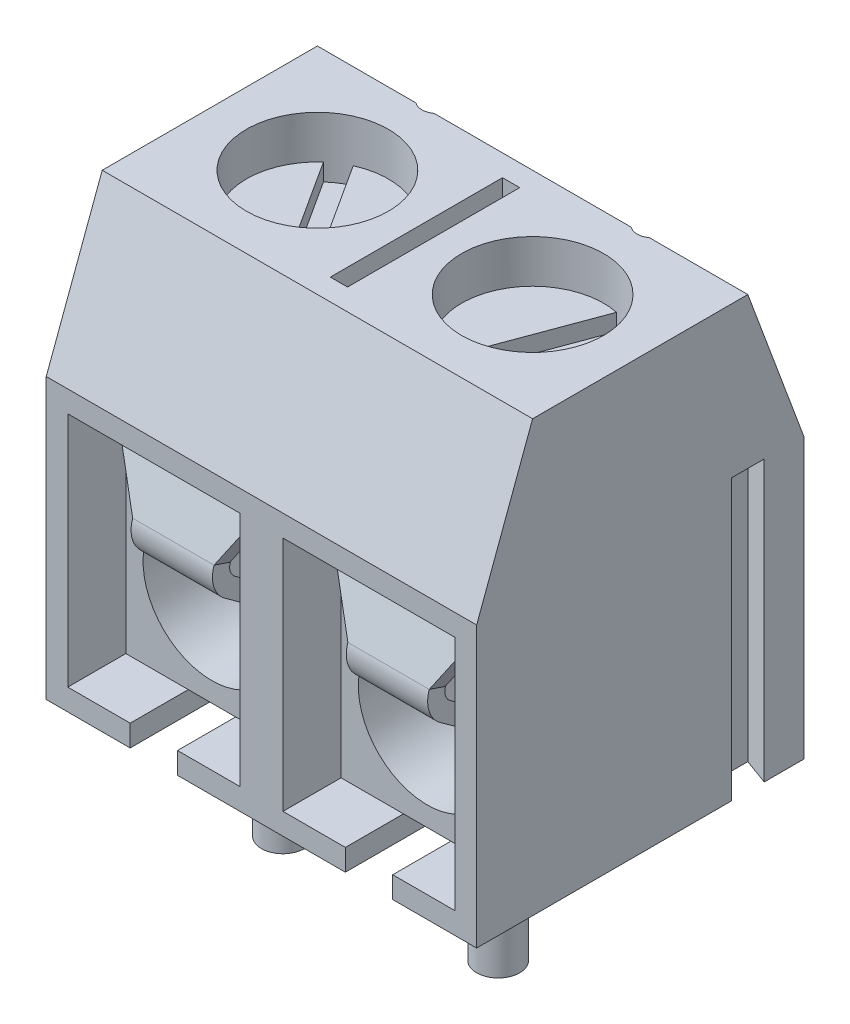
from build123d import *

# Parameters (mm, degrees)
SKETCH1_W               = 10
SKETCH1_H               = 7.6
EXTRUDE1_DEPTH          = 10
CUT_EXTRUDE1_DEPTH      = 12.808471535
CUT_EXTRUDE1_DEPTH_BACK = 12.808471535
SKETCH2_OUTSIDE_W       = 12.81
SKETCH2_OUTSIDE_H       = 15.21
SKETCH3_R               = 1.65
SKETCH3_R_2             = 0.35
SKETCH3_W               = 0.4
SKETCH3_H               = 4
CUT_EXTRUDE2_DEPTH      = 4
SKETCH4_W               = 4
SKETCH4_H               = 5.5
CUT_EXTRUDE3_DEPTH      = 5.6
SKETCH5_W               = 4
SKETCH5_H               = 5.1
EXTRUDE2_DEPTH          = 4.25
SKETCH6_R               = 1.6
CUT_EXTRUDE4_DEPTH      = 4.25
EXTRUDE3_DEPTH          = 6.5
CUT_EXTRUDE5_DEPTH      = 6.5
SKETCH10_W              = 1.1
SKETCH10_H              = 0.5
CUT_EXTRUDE6_DEPTH      = 3.6
SKETCH11_R              = 0.5
EXTRUDE4_DEPTH          = 3.5
EXTRUDE5_START          = -3
SKETCH12_R              = 1.65
EXTRUDE5_DEPTH          = 3
CUT_EXTRUDE7_DEPTH      = 0.4
EXTRUDE6_DEPTH          = 0.945
EXTRUDE9_DEPTH          = 0.39
LPATTERN1_COUNT         = 2
LPATTERN1_PITCH         = 5
FILLET1_R               = 0.3
FILLET2_R               = 0.7


with BuildPart() as part:
    # Sketch1 → Extrude1 (new body)
    with BuildSketch(Plane(origin=(0, 0, 0), x_dir=(1, 0, 0), z_dir=(0, 1, 0))):
        Rectangle(SKETCH1_W, SKETCH1_H)
    extrude(amount=EXTRUDE1_DEPTH)

    # Sketch2 outside → Cut-Extrude1 (cut, two sides: drawn at the far end of the back side and taken through both)
    with BuildSketch(Plane(origin=(0, 0, 0), x_dir=(0, 0, -1), z_dir=(1, 0, 0)).offset(-CUT_EXTRUDE1_DEPTH_BACK)):
        with Locations((0, 5)):
            Rectangle(SKETCH2_OUTSIDE_W, SKETCH2_OUTSIDE_H)
        Polygon((2.5, 10), (3.8, 6.5), (3.8, 0), (-3.8, 0), (-3.8, 6.5), (-2.5, 10), align=None, mode=Mode.SUBTRACT)
    extrude(amount=CUT_EXTRUDE1_DEPTH + CUT_EXTRUDE1_DEPTH_BACK, mode=Mode.SUBTRACT)

    # Sketch3 → Cut-Extrude2 (cut)
    with BuildSketch(Plane(origin=(0, 10, 0), x_dir=(-1, 0, 0), z_dir=(0, 1, 0))):
        with Locations(Location((2.5, 0, 0), (0, 0, 90))):
            Circle(SKETCH3_R)
        with Locations(Location((-2.5, 0, 0), (0, 0, 90))):
            Circle(SKETCH3_R)
        with Locations(Location((2.5, -2.78, 0), (0, 0, 90))):
            Circle(SKETCH3_R_2)
        with Locations(Location((-2.5, -2.78, 0), (0, 0, 90))):
            Circle(SKETCH3_R_2)
        Rectangle(SKETCH3_W, SKETCH3_H)
    extrude(amount=-CUT_EXTRUDE2_DEPTH, mode=Mode.SUBTRACT)

    # Sketch4 → Cut-Extrude3 (cut)
    with BuildSketch(Plane.XY.offset(3.8)):
        with Locations((-2.5, 3.25)):
            Rectangle(SKETCH4_W, SKETCH4_H)
        with Locations((2.5, 3.25)):
            Rectangle(SKETCH4_W, SKETCH4_H)
    extrude(amount=-CUT_EXTRUDE3_DEPTH, mode=Mode.SUBTRACT)

    # Sketch5 → Extrude2 (add)
    with BuildSketch(Plane.XY.offset(-1.8)):
        with Locations((-2.5, 3.05)):
            Rectangle(SKETCH5_W, SKETCH5_H)
        with Locations((2.5, 3.05)):
            Rectangle(SKETCH5_W, SKETCH5_H)
    extrude(amount=EXTRUDE2_DEPTH)

    # Sketch6 → Cut-Extrude4 (cut)
    with BuildSketch(Plane.XY.offset(2.45)):
        with Locations((-2.5, 2.554263468)):
            Circle(SKETCH6_R)
        with Locations((2.5, 2.554263468)):
            Circle(SKETCH6_R)
    extrude(amount=-CUT_EXTRUDE4_DEPTH, mode=Mode.SUBTRACT)

    # Sketch7 → Extrude3 (add)
    with BuildSketch(Plane(origin=(0, 0, 0), x_dir=(1, 0, 0), z_dir=(0, 1, 0))):
        Polygon((-5.6, 3.1), (-5, 2.881617859), (-5, 2.118382141), (-5.6, 1.9), align=None)
    extrude(amount=EXTRUDE3_DEPTH)

    # Sketch9 → Cut-Extrude5 (cut)
    with BuildSketch(Plane(origin=(0, 0, 0), x_dir=(1, 0, 0), z_dir=(0, 1, 0))):
        Polygon((5, 2.881617859), (4.4, 3.1), (4.4, 1.9), (5, 2.118382141), align=None)
    extrude(amount=CUT_EXTRUDE5_DEPTH, mode=Mode.SUBTRACT)

    # Sketch10 → Cut-Extrude6 (cut)
    with BuildSketch(Plane.XY.offset(3.8)):
        with Locations((-2.5, 0.25)):
            Rectangle(SKETCH10_W, SKETCH10_H)
        with Locations((2.5, 0.25)):
            Rectangle(SKETCH10_W, SKETCH10_H)
    extrude(amount=-CUT_EXTRUDE6_DEPTH, mode=Mode.SUBTRACT)

    # Sketch11 → Extrude4 (add)
    with BuildSketch(Plane.XZ.offset(-0.5)):
        with Locations(Location((-2.5, 0.8, 0), (0, 0, 90))):
            Circle(SKETCH11_R)
        with Locations(Location((2.5, 0.8, 0), (0, 0, 90))):
            Circle(SKETCH11_R)
    extrude(amount=EXTRUDE4_DEPTH)

    # Sketch12 → Extrude5 (add)
    with BuildSketch(Plane.XZ.offset(-6).offset(EXTRUDE5_START)):
        with Locations(Location((2.5, 0, 0), (0, 0, 90))):
            Circle(SKETCH12_R)
        with Locations(Location((-2.5, 0, 0), (0, 0, 90))):
            Circle(SKETCH12_R)
    extrude(amount=EXTRUDE5_DEPTH)

    # Sketch13 → Cut-Extrude7 (cut)
    with BuildSketch(Plane(origin=(0, 9, 0), x_dir=(-1, 0, 0), z_dir=(0, 1, 0))):
        with BuildLine():
            Line((3.594307251, -1.234905519), (1.825829895, 1.505986278))
            ThreePointArc((1.825829895, 1.505986278), (1.605433494, 1.386452583), (1.405692749, 1.234905519))
            Line((1.405692749, 1.234905519), (3.174170105, -1.505986278))
            ThreePointArc((3.174170105, -1.505986278), (3.394566506, -1.386452583), (3.594307251, -1.234905519))
        make_face()
        with BuildLine():
            Line((-2.83217089, -1.616218581), (-1.698971441, 1.44251629))
            ThreePointArc((-1.698971441, 1.44251629), (-1.926782442, 1.54723031), (-2.16782911, 1.616218581))
            Line((-2.16782911, 1.616218581), (-3.301028559, -1.44251629))
            ThreePointArc((-3.301028559, -1.44251629), (-3.073217558, -1.54723031), (-2.83217089, -1.616218581))
        make_face()
    extrude(amount=-CUT_EXTRUDE7_DEPTH, mode=Mode.SUBTRACT)

    # Sketch14 → Extrude6 (add, symmetric)
    with BuildSketch(Plane.ZY.offset(2.5)):
        Polygon((2.45, 5.6), (3.03887637, 3.861674443), (0.167170254, 1.787608865), (-0.546359637, 2.097431054), (-0.705673534, 1.730526322), (0.216750724, 1.33), (3.512480259, 3.710312924), (2.736824279, 6), (-1.8, 6), (-1.8, 5.6), align=None)
    extrude6 = extrude(amount=EXTRUDE6_DEPTH, both=True)

    # Sketch15 → Extrude9 (add)
    with BuildSketch(Plane(origin=(0, 1.449355072, 4.278403908), x_dir=(1, 0, 0), z_dir=(0, 0.32085037888995993, 0.9471298930802308))):
        Polygon((-1.555, 4.8), (-1.555, 2.903968921), (-0.51, 4.8), align=None)
        Polygon((-3.445, 4.8), (-3.445, 2.903968921), (-4.49, 4.8), align=None)
    extrude9 = extrude(amount=-EXTRUDE9_DEPTH)

    # LPattern1: Extrude6, Extrude9 ×2
    with Locations(*[(i * LPATTERN1_PITCH, 0, 0) for i in range(1, LPATTERN1_COUNT)]):
        add(extrude6)
        add(extrude9)

    # Fillet1
    fillet1_edges = [part.edges().sort_by_distance(p)[0] for p in [
        (-2.5, 3.861674443, 3.03887637),
        (-2.5, 1.787608865, 0.167170254),
        (2.5, 3.861674443, 3.03887637),
        (2.5, 1.787608865, 0.167170254),
    ]]
    fillet(fillet1_edges, radius=FILLET1_R)

    # Fillet2
    fillet2_edges = [part.edges().sort_by_distance(p)[0] for p in [
        (-2.5, 3.710312924, 3.512480259),
        (-2.5, 1.33, 0.216750724),
        (2.5, 1.33, 0.216750724),
        (2.5, 3.710312924, 3.512480259),
    ]]
    fillet(fillet2_edges, radius=FILLET2_R)


solid = part.part
